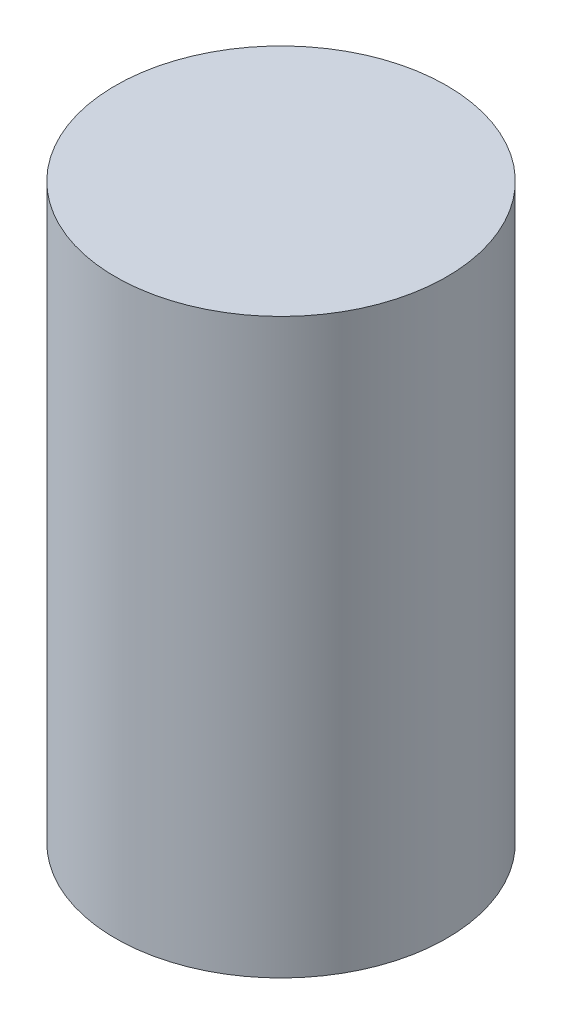
from build123d import *

# Parameters (mm, degrees)
SKETCH1_R           = 4.8
BOSS_EXTRUDE1_DEPTH = 16.6


with BuildPart() as part:
    # Sketch1 → Boss-Extrude1 (new body)
    with BuildSketch(Plane(origin=(0, 0, 0), x_dir=(1, 0, 0), z_dir=(0, 1, 0))):
        with Locations(Location((0, 0, 0), (0, 0, 90))):
            Circle(SKETCH1_R)
    extrude(amount=BOSS_EXTRUDE1_DEPTH)


solid = part.part
